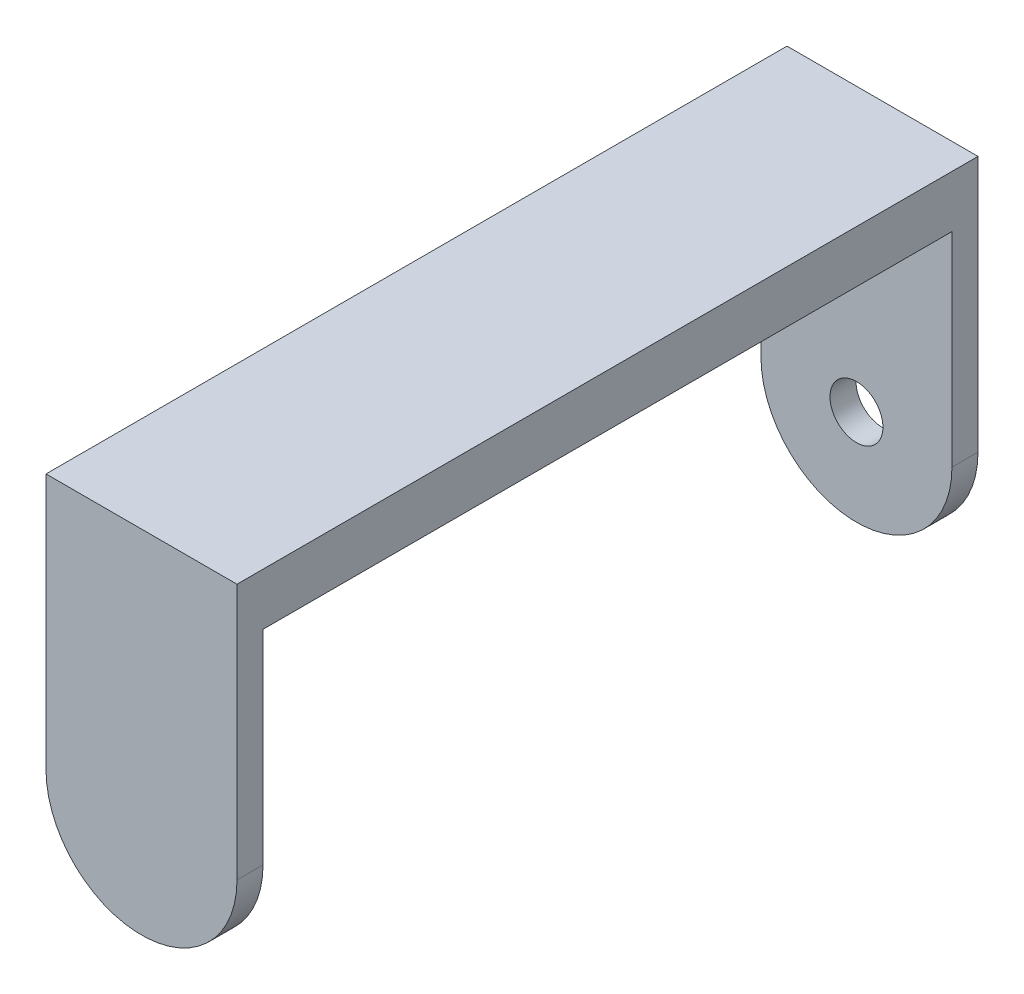
from build123d import *

# Parameters (mm, degrees)
ESBO_O1_R                = 3.05
RESSALTO_EXTRUS_O1_DEPTH = 3
ESBO_O2_W                = 22
ESBO_O2_H                = 82.35
RESSALTO_EXTRUS_O2_DEPTH = 3
RESSALTO_EXTRUS_O3_START = 3
RESSALTO_EXTRUS_O3_DEPTH = 3
ESBO_O6_W                = 85.35
ESBO_O6_H                = 6
RESSALTO_EXTRUS_O5_DEPTH = 3
ESBO_O7_R                = 2.75
RESSALTO_EXTRUS_O6_DEPTH = 0.6


with BuildPart() as part:
    # Esboço1 → Ressalto-extrusão1 (new body)
    with BuildSketch(Plane.XY):
        with BuildLine():
            Line((11, -1.428145739), (11, 25.071854261))
            Line((11, 25.071854261), (-11, 25.071854261))
            Line((-11, 25.071854261), (-11, -1.428145739))
            ThreePointArc((-11, -1.428145739), (0, -12.428145739), (11, -1.428145739))
        make_face()
        with Locations((0, -1.428145739)):
            Circle(ESBO_O1_R, mode=Mode.SUBTRACT)
    extrude(amount=-RESSALTO_EXTRUS_O1_DEPTH)

    # Esboço2 → Ressalto-extrusão2 (add)
    with BuildSketch(Plane(origin=(0, 25.071854261, 0), x_dir=(1, 0, 0), z_dir=(0, 1, 0))):
        with Locations((0, -38.175)):
            Rectangle(ESBO_O2_W, ESBO_O2_H)
    extrude(amount=RESSALTO_EXTRUS_O2_DEPTH)

    # Esboço3 → Ressalto-extrusão3 (add)
    with BuildSketch(Plane.XY.offset(79.35).offset(RESSALTO_EXTRUS_O3_START)):
        with BuildLine():
            Line((11, 28.071854261), (-11, 28.071854261))
            Line((-11, 28.071854261), (-11, -1.428145739))
            ThreePointArc((-11, -1.428145739), (0, -12.428145739), (11, -1.428145739))
            Line((11, -1.428145739), (11, 28.071854261))
        make_face()
    extrude(amount=-RESSALTO_EXTRUS_O3_DEPTH)

    # Esboço6 → Ressalto-extrusão5 (add)
    with BuildSketch(Plane(origin=(11, 0, 0), x_dir=(0, 0, -1), z_dir=(1, 0, 0))):
        with Locations((-39.675, 25.071854261)):
            Rectangle(ESBO_O6_W, ESBO_O6_H)
    ressalto_extrus_o5 = extrude(amount=-RESSALTO_EXTRUS_O5_DEPTH)

    # Espelhar1: Ressalto-extrusão5 across plane
    add(ressalto_extrus_o5.mirror(Plane(origin=(0, 0, 0), x_dir=(0, 0, 1), z_dir=(1, 0, 0))))

    # Esboço7 → Ressalto-extrusão6 (add)
    with BuildSketch(Plane(origin=(0, 0, 79.35), x_dir=(-1, 0, 0), z_dir=(0, 0, -1))):
        with Locations(Location((0, -1.428145739, 0), (0, 0, 180))):
            Circle(ESBO_O7_R)
    extrude(amount=RESSALTO_EXTRUS_O6_DEPTH)


solid = part.part
